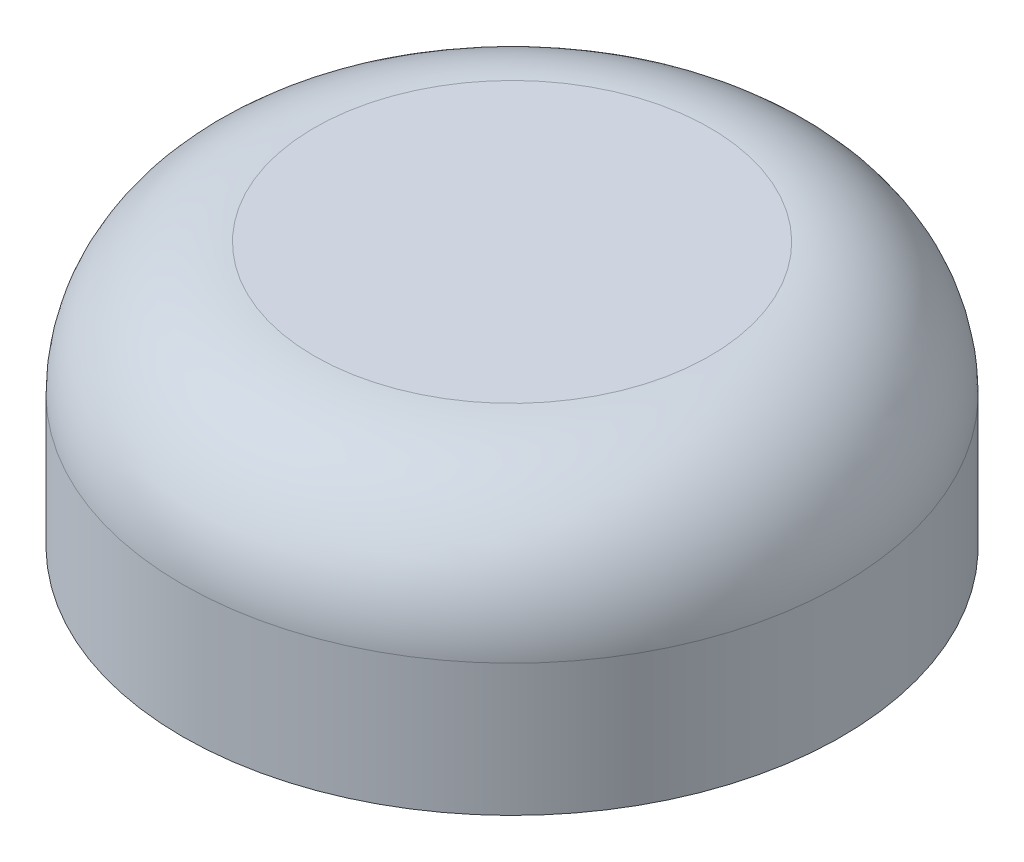
from build123d import *

# Parameters (mm, degrees)
CROQUIS1_R              = 2.5
SALIENTE_EXTRUIR1_DEPTH = 2
REDONDEO1_R             = 1
CROQUIS2_R              = 1.5
CORTAR_EXTRUIR1_DEPTH   = 1


with BuildPart() as part:
    # Croquis1 → Saliente-Extruir1 (new body)
    with BuildSketch(Plane(origin=(0, 0, 0), x_dir=(1, 0, 0), z_dir=(0, 1, 0))):
        with Locations(Location((0, 0, 0), (0, 0, 270))):
            Circle(CROQUIS1_R)
    extrude(amount=SALIENTE_EXTRUIR1_DEPTH)

    # Redondeo1
    redondeo1_edges = [part.edges().sort_by_distance(p)[0] for p in [
        (0, 2, -2.5),
    ]]
    fillet(redondeo1_edges, radius=REDONDEO1_R)

    # Croquis2 → Cortar-Extruir1 (cut)
    with BuildSketch(Plane.XZ):
        with Locations(Location((0, 0, 0), (0, 0, 270))):
            Circle(CROQUIS2_R)
    extrude(amount=-CORTAR_EXTRUIR1_DEPTH, mode=Mode.SUBTRACT)


solid = part.part
